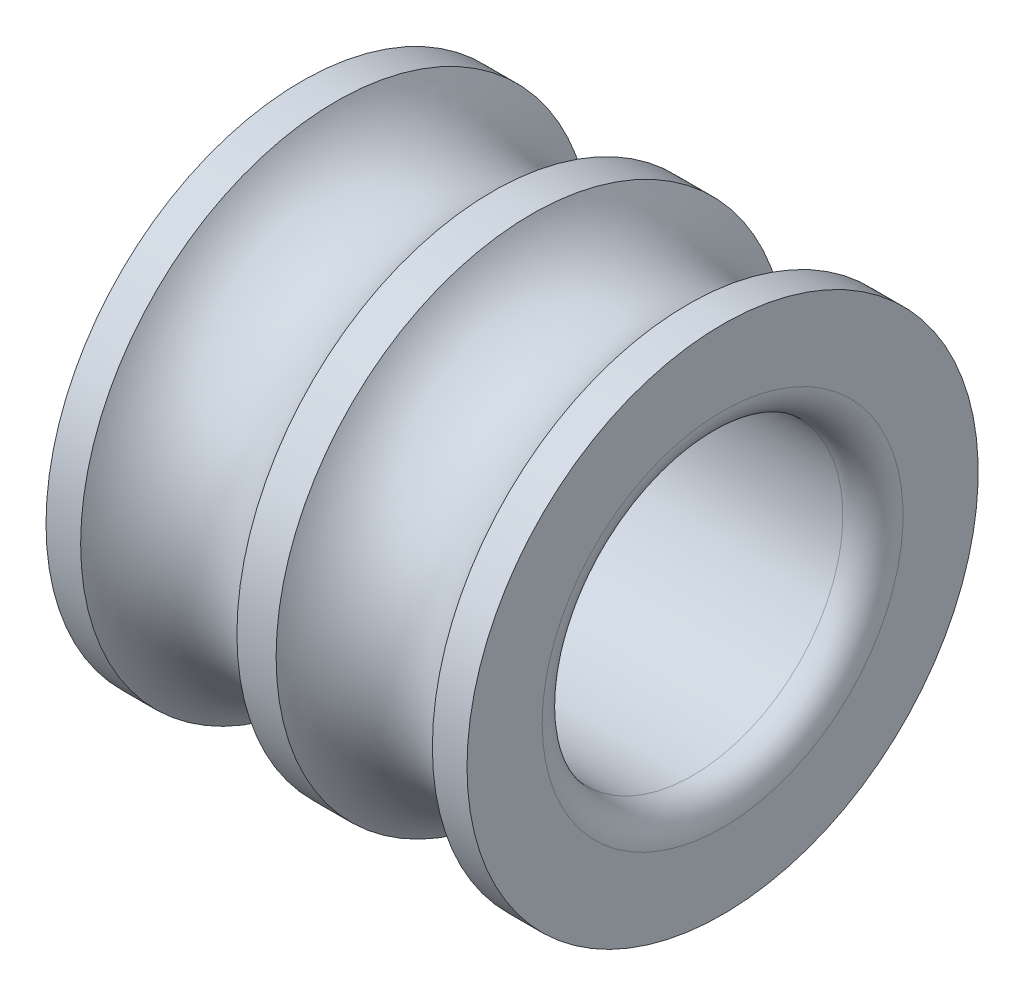
from build123d import *

# Parameters (mm, degrees)
CONG_1_R = 1


with BuildPart() as part:
    # Esquisse1 → Base-Révolution (revolve)
    with BuildSketch(Plane.XY, mode=Mode.PRIVATE) as base_r_volution_sk:
        with BuildLine():
            Line((0, 5), (14, 5))
            Line((14, 5), (14, 8.5))
            Line((14, 8.5), (12.848076211, 8.5))
            ThreePointArc((12.848076211, 8.5), (10.25, 7), (7.651923789, 8.5))
            Line((7.651923789, 8.5), (6.348076211, 8.5))
            ThreePointArc((6.348076211, 8.5), (3.75, 7), (1.151923789, 8.5))
            Line((1.151923789, 8.5), (0, 8.5))
            Line((0, 8.5), (0, 5))
        make_face()
    revolve(base_r_volution_sk.sketch.rotate(Axis((0, 0, 0), (1, 0, 0)), 90), axis=Axis((0, 0, 0), (1, 0, 0)))

    # Congé1
    cong_1_edges = [part.edges().sort_by_distance(p)[0] for p in [
        (14, 0, -5),
        (0, 0, -5),
    ]]
    fillet(cong_1_edges, radius=CONG_1_R)


solid = part.part
